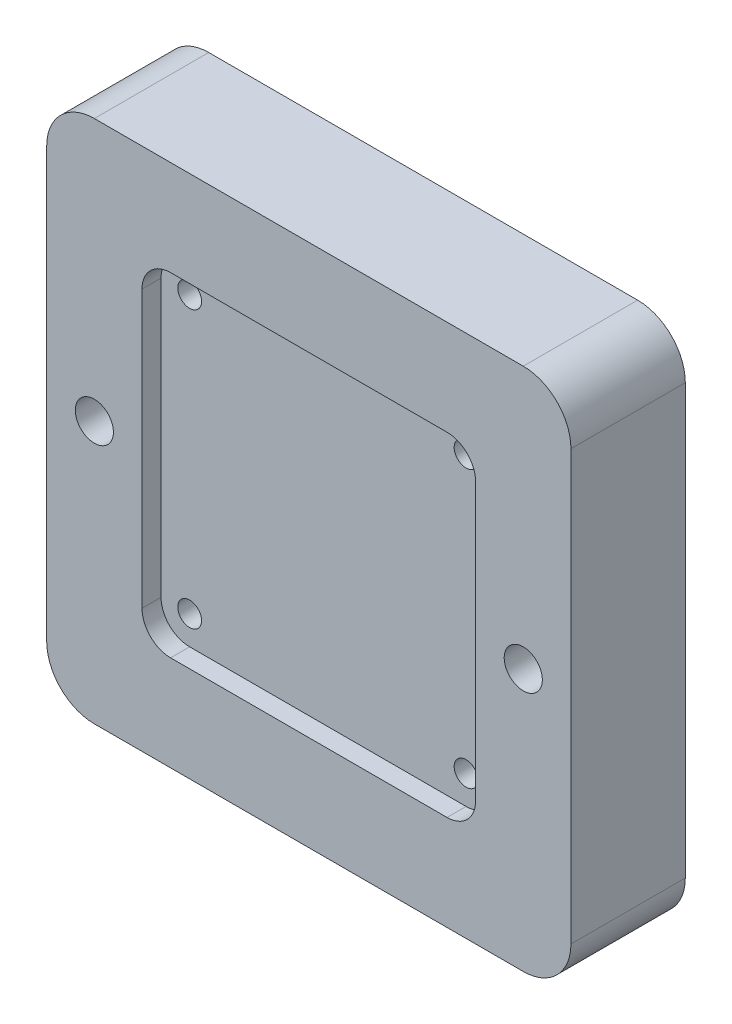
from build123d import *

# Parameters (mm, degrees)
BOSS_EXTRUDE1_DEPTH             = 4
BOSS_EXTRUDE2_DEPTH             = 20
F_8_0MM_DOWEL_HOLE1_D           = 8
F_8_0MM_DOWEL_HOLE1_DEPTH       = 18
F_8_0MM_DOWEL_HOLE1_TIP         = 2.403442476
TAP_DRILL_FOR_M6X1_0_TAP1_D     = 5
TAP_DRILL_FOR_M6X1_0_TAP1_DEPTH = 10
TAP_DRILL_FOR_M6X1_0_TAP1_TIP   = 1.502151548


with BuildPart() as part:
    # Sketch1 → Boss-Extrude1 (new body)
    with BuildSketch(Plane.XY):
        with BuildLine():
            Line((-45, 55), (45, 55))
            ThreePointArc((45, 55), (52.071067812, 52.071067812), (55, 45))
            Line((55, 45), (55, -45))
            ThreePointArc((55, -45), (52.071067812, -52.071067812), (45, -55))
            Line((45, -55), (-45, -55))
            ThreePointArc((-45, -55), (-52.071067812, -52.071067812), (-55, -45))
            Line((-55, -45), (-55, 45))
            ThreePointArc((-55, 45), (-52.071067812, 52.071067812), (-45, 55))
        make_face()
        with BuildLine():
            Line((-29, 35), (29, 35))
            ThreePointArc((29, 35), (33.242640687, 33.242640687), (35, 29))
            Line((35, 29), (35, -29))
            ThreePointArc((35, -29), (33.242640687, -33.242640687), (29, -35))
            Line((29, -35), (-29, -35))
            ThreePointArc((-29, -35), (-33.242640687, -33.242640687), (-35, -29))
            Line((-35, -29), (-35, 29))
            ThreePointArc((-35, 29), (-33.242640687, 33.242640687), (-29, 35))
        make_face(mode=Mode.SUBTRACT)
    extrude(amount=-BOSS_EXTRUDE1_DEPTH)

    # Sketch2 → Boss-Extrude2 (add)
    with BuildSketch(Plane.XY.offset(-4)):
        with BuildLine():
            Line((-45, -55), (45, -55))
            ThreePointArc((45, -55), (52.071067812, -52.071067812), (55, -45))
            Line((55, -45), (55, 45))
            ThreePointArc((55, 45), (52.071067812, 52.071067812), (45, 55))
            Line((45, 55), (-45, 55))
            ThreePointArc((-45, 55), (-52.071067812, 52.071067812), (-55, 45))
            Line((-55, 45), (-55, -45))
            ThreePointArc((-55, -45), (-52.071067812, -52.071067812), (-45, -55))
        make_face()
    extrude(amount=-BOSS_EXTRUDE2_DEPTH)

    # Ø8.0mm Dowel Hole1
    with Locations(Plane.XY):
        with Locations((-45, 0), (45, 0)):
            Hole(F_8_0MM_DOWEL_HOLE1_D / 2, depth=F_8_0MM_DOWEL_HOLE1_DEPTH)
            with Locations((0, 0, -(F_8_0MM_DOWEL_HOLE1_DEPTH + F_8_0MM_DOWEL_HOLE1_TIP / 2))):  # 118° drill point
                Cone(0, F_8_0MM_DOWEL_HOLE1_D / 2, F_8_0MM_DOWEL_HOLE1_TIP, mode=Mode.SUBTRACT)

    # Tap Drill for M6x1.0 Tap1
    with Locations(Plane.XY.offset(-4)):
        with Locations((-29, 29), (29, 29), (29, -29), (-29, -29)):
            Hole(TAP_DRILL_FOR_M6X1_0_TAP1_D / 2, depth=TAP_DRILL_FOR_M6X1_0_TAP1_DEPTH)
            with Locations((0, 0, -(TAP_DRILL_FOR_M6X1_0_TAP1_DEPTH + TAP_DRILL_FOR_M6X1_0_TAP1_TIP / 2))):  # 118° drill point
                Cone(0, TAP_DRILL_FOR_M6X1_0_TAP1_D / 2, TAP_DRILL_FOR_M6X1_0_TAP1_TIP, mode=Mode.SUBTRACT)


solid = part.part
